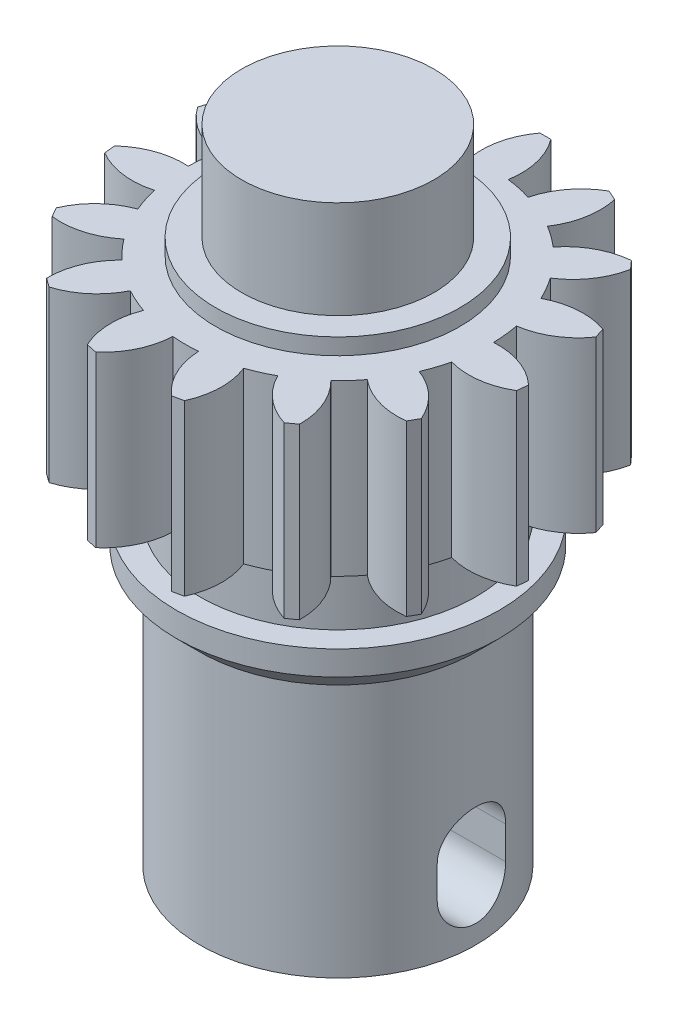
from build123d import *
from build123d.topology import SkipClean

# Parameters (mm, degrees)
RESSALTO_EXTRUS_O1_START = -10.4
RESSALTO_EXTRUS_O1_DEPTH = 10.4
PADR_OCIRCULAR1_COUNT    = 15
CORTE_EXTRUS_O1_DEPTH    = 22
ESBO_O4_R                = 3.25
CORTE_EXTRUS_O2_DEPTH    = 4
CORTE_EXTRUS_O4_DEPTH    = 20


with BuildPart() as part:
    # Esboço1 → Revolução1 (revolve)
    with BuildSketch(Plane.XY, mode=Mode.PRIVATE) as revolu_o1_sk:
        Polygon((0, 0), (0, 39.4), (5.9, 39.4), (5.9, 33.4), (7.5, 33.4), (7.5, 32.4), (9.374, 32.4), (9.374, 22), (8.47, 22), (8.47, 18.51), (9.9, 18.51), (9.9, 17.01), (8.47, 15.58), (8.47, 0), align=None)
    revolve(revolu_o1_sk.sketch.rotate(Axis((0, 0, 0), (0, 1, 0)), 90), axis=Axis((0, 0, 0), (0, 1, 0)))

    # Esboço2 → Ressalto-extrusão1 (add)
    with BuildSketch(Plane(origin=(0, 32.4, 0), x_dir=(1, 0, 0), z_dir=(0, 1, 0)).offset(RESSALTO_EXTRUS_O1_START)):
        with BuildLine():
            Line((-0.337, 12.746), (0.337, 12.746))
            ThreePointArc((0.337, 12.746), (1.105703178, 11.108702403), (1.167644885, 9.300993572))
            ThreePointArc((1.167644885, 9.300993572), (0, 9.374), (-1.167644885, 9.300993572))
            ThreePointArc((-1.167644885, 9.300993572), (-1.105703178, 11.108702403), (-0.337, 12.746))
        make_face()
    ressalto_extrus_o1 = extrude(amount=RESSALTO_EXTRUS_O1_DEPTH)

    # PadrãoCircular1: Ressalto-extrusão1 ×15 about axis
    padr_ocircular1_axis = Axis((0, 0, 0), (0, 1, 0))
    for i in range(1, PADR_OCIRCULAR1_COUNT):
        add(ressalto_extrus_o1.rotate(padr_ocircular1_axis, i * 360 / PADR_OCIRCULAR1_COUNT))

    # Esboço3 → Corte-extrusão1 (cut)
    with BuildSketch(Plane.XZ):
        with BuildLine():
            Line((2.75, 1.732050808), (2.75, -1.732050808))
            ThreePointArc((2.75, -1.732050808), (-3.25, 0), (2.75, 1.732050808))
        make_face()
    extrude(amount=-CORTE_EXTRUS_O1_DEPTH, mode=Mode.SUBTRACT)

    # Esboço4 → Corte-extrusão2 (cut)
    with SkipClean():  # the faces are left unmerged after this step: merging them gives an invalid solid
        with BuildSketch(Plane.XZ):
            with Locations(Location((0, 0, 0), (0, 0, 270))):
                Circle(ESBO_O4_R)
        extrude(amount=-CORTE_EXTRUS_O2_DEPTH, mode=Mode.SUBTRACT)

    # Esboço7 → Corte-extrusão4 (cut, symmetric)
    with SkipClean():  # the faces are left unmerged after this step: merging them gives an invalid solid
        with BuildSketch(Plane(origin=(0, 0, 0), x_dir=(0, 0, -1), z_dir=(1, 0, 0))):
            with BuildLine():
                Line((-2.1, 5.25), (-2.1, 3.25))
                ThreePointArc((-2.1, 3.25), (0, 1.15), (2.1, 3.25))
                Line((2.1, 3.25), (2.1, 5.25))
                ThreePointArc((2.1, 5.25), (0, 7.35), (-2.1, 5.25))
            make_face()
        extrude(amount=CORTE_EXTRUS_O4_DEPTH, both=True, mode=Mode.SUBTRACT)


solid = part.part
